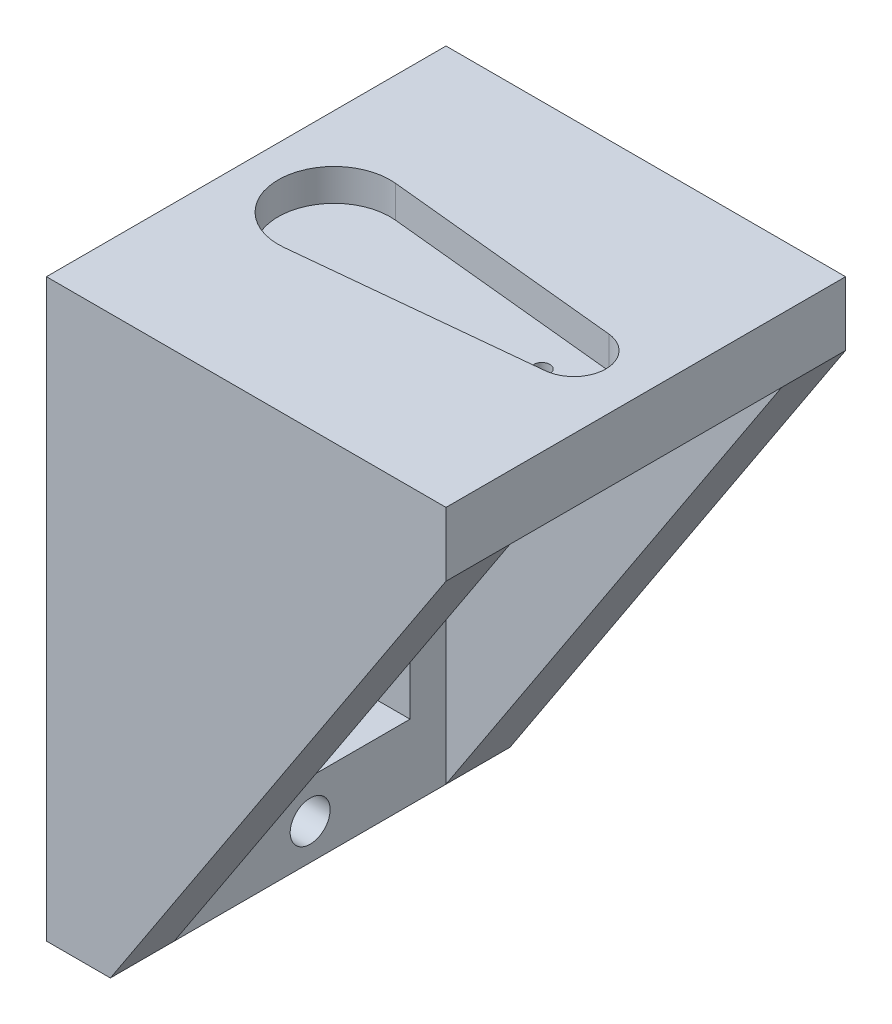
from build123d import *

# Parameters (mm, degrees)
SKETCH_2_W               = 25
SKETCH_2_H               = 25
EXTRUDE_1_DEPTH          = 4
EXTRUDE_2_DEPTH          = 4
CUT_EXTRUDE_START        = -6
CUT_EXTRUDE_1_DEPTH      = 6
SKETCH_8_R               = 0.5
CUT_EXTRUDE_2_DEPTH      = 6
SKETCH_11_W              = 20.999639265
SKETCH_11_H              = 4
EXTRUDE_3_DEPTH          = 32
CUT_EXTRUDE_4_DEPTH      = 32
CUT_EXTRUDE_4_DEPTH_BACK = 32
SKETCH_13_R              = 1.25
SKETCH_13_W              = 12.5
SKETCH_13_H              = 22.7
CUT_EXTRUDE_5_DEPTH      = 41.264560711


with BuildPart() as part:
    # 草图2 → 凸台-拉伸1 (new body)
    with BuildSketch(Plane(origin=(0, 0, 0), x_dir=(1, 0, 0), z_dir=(0, 1, 0))):
        Rectangle(SKETCH_2_W, SKETCH_2_H)
    extrude(amount=EXTRUDE_1_DEPTH)

    # 草图3 → 凸台-拉伸2 (add)
    with BuildSketch(Plane(origin=(0, 4, 0), x_dir=(1, 0, 0), z_dir=(0, 1, 0))):
        with BuildLine():
            ThreePointArc((-3.5, 0), (-4.40433053, 2.347871376), (-6.65, 3.48245603))
            Line((-6.65, 3.48245603), (-6.65, -3.48245603))
            ThreePointArc((-6.65, -3.48245603), (-4.40433053, -2.347871376), (-3.5, 0))
        make_face()
        with BuildLine():
            Line((-6.65, -3.48245603), (-6.65, 3.48245603))
            ThreePointArc((-6.65, 3.48245603), (-10.5, 0), (-6.65, -3.48245603))
        make_face()
        with BuildLine():
            ThreePointArc((-3.5, 0), (-4.40433053, 2.347871376), (-6.65, 3.48245603))
            Line((-6.65, 3.48245603), (-6.65, -3.48245603))
            ThreePointArc((-6.65, -3.48245603), (-4.40433053, -2.347871376), (-3.5, 0))
        make_face()
        with BuildLine():
            Line((-6.65, -3.48245603), (-6.65, 3.48245603))
            ThreePointArc((-6.65, 3.48245603), (-10.5, 0), (-6.65, -3.48245603))
        make_face()
        with BuildLine():
            Line((8.2, 1.989974874), (-6.65, 3.48245603))
            ThreePointArc((-6.65, 3.48245603), (-4.40433053, 2.347871376), (-3.5, 0))
            ThreePointArc((-3.5, 0), (-4.40433053, -2.347871376), (-6.65, -3.48245603))
            Line((-6.65, -3.48245603), (8.2, -1.989974874))
            ThreePointArc((8.2, -1.989974874), (6, 0), (8.2, 1.989974874))
        make_face()
        with BuildLine():
            ThreePointArc((10, 0), (9.483239697, 1.341640786), (8.2, 1.989974874))
            Line((8.2, 1.989974874), (8.2, -1.989974874))
            ThreePointArc((8.2, -1.989974874), (9.483239697, -1.341640786), (10, 0))
        make_face()
        with BuildLine():
            Line((8.2, -1.989974874), (8.2, 1.989974874))
            ThreePointArc((8.2, 1.989974874), (6, 0), (8.2, -1.989974874))
        make_face()
        with BuildLine():
            ThreePointArc((10, 0), (9.483239697, 1.341640786), (8.2, 1.989974874))
            Line((8.2, 1.989974874), (8.2, -1.989974874))
            ThreePointArc((8.2, -1.989974874), (9.483239697, -1.341640786), (10, 0))
        make_face()
        with BuildLine():
            Line((8.2, -1.989974874), (8.2, 1.989974874))
            ThreePointArc((8.2, 1.989974874), (6, 0), (8.2, -1.989974874))
        make_face()
    extrude(amount=EXTRUDE_2_DEPTH)

    # 草图7 → 切除-拉伸1 (cut)
    with BuildSketch(Plane(origin=(0, 8, 0), x_dir=(1, 0, 0), z_dir=(0, 1, 0)).offset(CUT_EXTRUDE_START)):
        with BuildLine():
            Line((-6.65, -3.48245603), (8.2, -1.989974874))
            ThreePointArc((8.2, -1.989974874), (10, 0), (8.2, 1.989974874))
            Line((8.2, 1.989974874), (-6.65, 3.48245603))
            ThreePointArc((-6.65, 3.48245603), (-10.5, 0), (-6.65, -3.48245603))
        make_face()
    extrude(amount=CUT_EXTRUDE_1_DEPTH, mode=Mode.SUBTRACT)

    # 草图8 → 切除-拉伸2 (cut)
    with BuildSketch(Plane(origin=(0, 2, 0), x_dir=(1, 0, 0), z_dir=(0, 1, 0))):
        with Locations(Location((6, 0, 0), (0, 0, 270))):
            Circle(SKETCH_8_R)
    extrude(amount=-CUT_EXTRUDE_2_DEPTH, mode=Mode.SUBTRACT)

    # 草图11 → 凸台-拉伸3 (add)
    with BuildSketch(Plane.XZ):
        with Locations((2.000180367, 10.5)):
            Rectangle(SKETCH_11_W, SKETCH_11_H)
        Polygon((-8.499639265, 8.5), (-8.499639265, 12.5), (-12.5, 12.5), (-12.5, -12.5), (-8.499639265, -12.5), (-8.499639265, -8.5), align=None)
        with Locations((2.000180367, -10.5)):
            Rectangle(SKETCH_11_W, SKETCH_11_H)
    extrude(amount=EXTRUDE_3_DEPTH)

    # 草图12 → 切除-拉伸4 (cut, two sides: drawn at the far end of the back side and taken through both)
    with BuildSketch(Plane.XY.offset(-8.5).offset(-CUT_EXTRUDE_4_DEPTH_BACK)):
        Polygon((12.5, 0), (-8.499639265, -32), (12.5, -32), align=None)
    extrude(amount=CUT_EXTRUDE_4_DEPTH + CUT_EXTRUDE_4_DEPTH_BACK, mode=Mode.SUBTRACT)

    # 草图13 → 切除-拉伸5 (cut, through all)
    with BuildSketch(Plane(origin=(-8.499639265, 0, 0), x_dir=(0, 0, -1), z_dir=(1, 0, 0))):
        with Locations((0, -29.75)):
            Circle(SKETCH_13_R)
        with Locations((0, -2.25)):
            Circle(SKETCH_13_R)
        with Locations((0, -16)):
            Rectangle(SKETCH_13_W, SKETCH_13_H)
    extrude(amount=-CUT_EXTRUDE_5_DEPTH, mode=Mode.SUBTRACT)


solid = part.part
